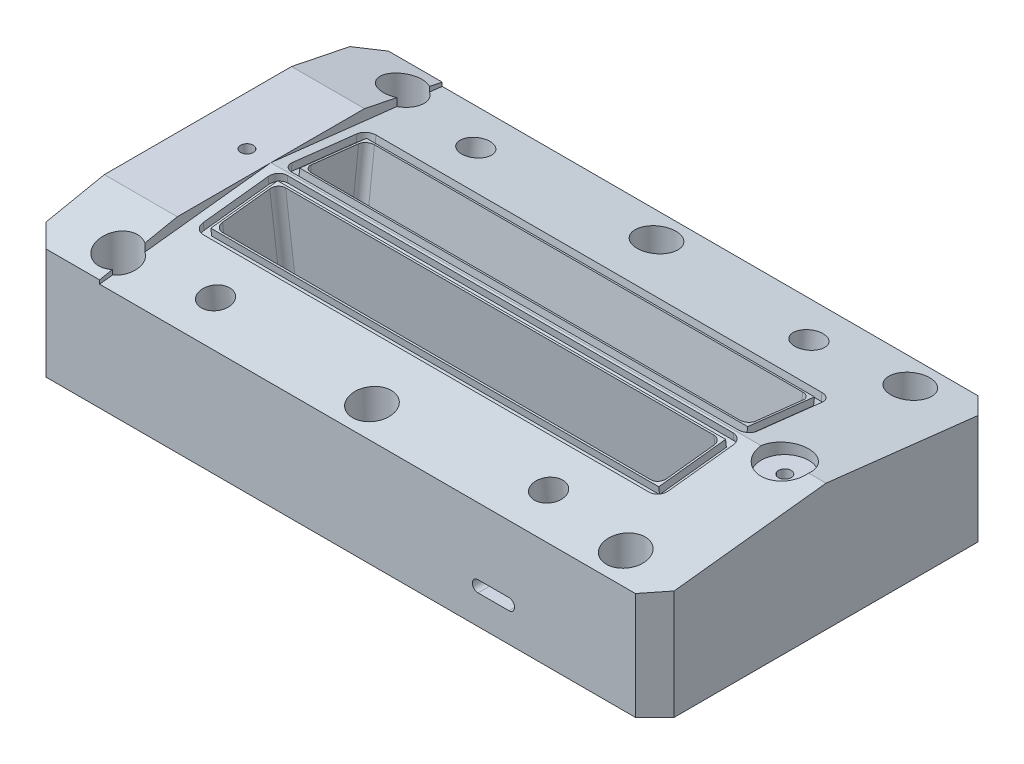
from build123d import *

# Parameters (mm, degrees)
SKETCH1_W            = 198
SKETCH1_H            = 108
BOSS_EXTRUDE1_DEPTH  = 40
SKETCH4_W            = 181
SKETCH4_H            = 45
CUT_EXTRUDE2_DEPTH   = 10
CUT_EXTRUDE3_DEPTH   = 175
BOSS_EXTRUDE11_DEPTH = 10
CUT_EXTRUDE12_DEPTH  = 175
CUT_EXTRUDE28_DEPTH  = 14.5
CUT_EXTRUDE29_DEPTH  = 14.5
CUT_EXTRUDE40_REACH  = 231.059
CUT_EXTRUDE5_DEPTH   = 23
SKETCH12_R           = 3.15
CUT_EXTRUDE9_DEPTH   = 230.058944379
SKETCH13_R           = 4.5
CUT_EXTRUDE10_DEPTH  = 16.5
SKETCH14_R           = 4.5
CUT_EXTRUDE11_DEPTH  = 16.5
SKETCH41_R           = 2.9
CUT_EXTRUDE21_DEPTH  = 7
CUT_EXTRUDE22_DEPTH  = 10
CUT_EXTRUDE23_DEPTH  = 10
SKETCH6_W            = 141.2
SKETCH6_H            = 21.2
CUT_EXTRUDE32_DEPTH  = 2.3
SKETCH23_W           = 141.2
SKETCH23_H           = 21.2
CUT_EXTRUDE33_DEPTH  = 2.3
CUT_EXTRUDE34_DEPTH  = 55.4
CUT_EXTRUDE35_DEPTH  = 55.4
CUT_EXTRUDE36_DEPTH  = 55.4
SKETCH90_R           = 6.1
CUT_EXTRUDE38_DEPTH  = 17
SKETCH96_R           = 2
CUT_EXTRUDE39_DEPTH  = 230.058944379
SKETCH98_R           = 7.5
CUT_EXTRUDE41_DEPTH  = 4


with BuildPart() as part:
    # Sketch1 → Boss-Extrude1 (new body)
    with BuildSketch(Plane(origin=(0, 0, 0), x_dir=(1, 0, 0), z_dir=(0, 1, 0))):
        with Locations((99, 54)):
            Rectangle(SKETCH1_W, SKETCH1_H)
    extrude(amount=BOSS_EXTRUDE1_DEPTH)

    # Sketch4 → Cut-Extrude2 (cut)
    with BuildSketch(Plane(origin=(0, 0, 0), x_dir=(1, 0, 0), z_dir=(0, 1, 0))):
        with Locations((99, 54)):
            Rectangle(SKETCH4_W, SKETCH4_H)
    extrude(amount=CUT_EXTRUDE2_DEPTH, mode=Mode.SUBTRACT)

    # Sketch5 → Cut-Extrude3 (cut)
    with BuildSketch(Plane(origin=(198, 0, 0), x_dir=(0, 0, -1), z_dir=(1, 0, 0))):
        Polygon((54, 40), (108, 33.828382143), (108, 40), align=None)
    extrude(amount=-CUT_EXTRUDE3_DEPTH, mode=Mode.SUBTRACT)

    # Sketch53 → Boss-Extrude11 (add)
    with BuildSketch(Plane(origin=(0, 10, 0), x_dir=(-1, 0, 0), z_dir=(0, -1, 0))):
        Polygon((-8.5, 51.5), (-8.5, 31.5), (-39.5, 31.5), align=None)
        Polygon((-8.5, 56.5), (-8.5, 76.5), (-39.5, 76.5), align=None)
        Polygon((-158.5, 76.5), (-189.5, 56.5), (-189.5, 76.5), align=None)
        Polygon((-158.5, 31.5), (-189.5, 51.5), (-189.5, 31.5), align=None)
    extrude(amount=BOSS_EXTRUDE11_DEPTH)

    # Sketch18 → Cut-Extrude12 (cut)
    with BuildSketch(Plane(origin=(198, 0, 0), x_dir=(0, 0, -1), z_dir=(1, 0, 0))):
        Polygon((0, 33.828382143), (0, 40), (54, 40), align=None)
    extrude(amount=-CUT_EXTRUDE12_DEPTH, mode=Mode.SUBTRACT)

    # Izq → Cut-Extrude28 (cut)
    with BuildSketch(Plane(origin=(0, 28.012686094, -12.204810084), x_dir=(1, 0, 0), z_dir=(0, 0.9167660546215652, -0.39942458749256926))):
        Polygon((8.5, 48.862182113), (29.5, 70.132603179), (8.5, 70.132603179), align=None)
    cut_extrude28 = extrude(amount=-CUT_EXTRUDE28_DEPTH, mode=Mode.SUBTRACT)

    # Der → Cut-Extrude29 (cut)
    with BuildSketch(Plane(origin=(0, -11.144923858, -4.62106599), x_dir=(1, 0, 0), z_dir=(0, 0.9237421135716327, 0.38301502270043264))):
        Polygon((8.5, 51.290217599), (29.5, 29.097876578), (8.5, 29.097876578), align=None)
    cut_extrude29 = extrude(amount=-CUT_EXTRUDE29_DEPTH, mode=Mode.SUBTRACT)

    # Cut-Extrude40: up to this face of the body (flat: up to its plane)
    cut_extrude40_end = Plane(part.part.faces().sort_by_distance((99, 10, -54))[0])
    # Sketch97 → Cut-Extrude40 (cut, up to the picked face)
    with BuildSketch(Plane(origin=(0, 0, 0), x_dir=(1, 0, 0), z_dir=(0, 1, 0)), mode=Mode.PRIVATE) as cut_extrude40_sk1:
        Polygon((8.5, 57.5), (29.5, 76.5), (158.5, 76.5), (189.5, 56.5), (189.5, 51.5), (158.5, 31.5), (29.5, 31.5), (8.5, 51.5), align=None)
    cut_extrude40_tool1 = split(extrude(cut_extrude40_sk1.sketch, amount=CUT_EXTRUDE40_REACH, mode=Mode.PRIVATE), bisect_by=cut_extrude40_end, keep=Keep.BOTH, mode=Mode.PRIVATE)
    cut_extrude40 = cut_extrude40_tool1.solids().sort_by(Axis((96.82024, 0, -54.014019), (0, 1, 0)))[0]
    add(cut_extrude40, mode=Mode.SUBTRACT)

    # Mirror2: Cut-Extrude28, Cut-Extrude29, Cut-Extrude40 across plane
    add(cut_extrude28.mirror(Plane(origin=(99, 0, 0), x_dir=(0, 0, 1), z_dir=(1, 0, 0))), mode=Mode.SUBTRACT)
    add(cut_extrude29.mirror(Plane(origin=(99, 0, 0), x_dir=(0, 0, 1), z_dir=(1, 0, 0))), mode=Mode.SUBTRACT)
    add(cut_extrude40.mirror(Plane(origin=(99, 0, 0), x_dir=(0, 0, 1), z_dir=(1, 0, 0))), mode=Mode.SUBTRACT)

    # Sketch7 → Cut-Extrude5 (cut)
    with BuildSketch(Plane(origin=(0, 0, 0), x_dir=(0, 0, -1), z_dir=(1, 0, 0))):
        Polygon((108, 40), (108, 35), (83.505102572, 40), align=None)
        Polygon((0, 35), (0, 40), (24.494897428, 40), align=None)
    extrude(amount=CUT_EXTRUDE5_DEPTH, mode=Mode.SUBTRACT)

    # Sketch12 → Cut-Extrude9 (cut, through all)
    with BuildSketch(Plane(origin=(0, 40, 0), x_dir=(1, 0, 0), z_dir=(0, 1, 0))):
        with Locations(Location((19.7, 98.85, 0), (0, 0, 270))):
            Circle(SKETCH12_R)
        with Locations(Location((99.7, 9.15, 0), (0, 0, 270))):
            Circle(SKETCH12_R)
        with Locations(Location((179.7, 9.15, 0), (0, 0, 270))):
            Circle(SKETCH12_R)
        with Locations(Location((19.7, 9.15, 0), (0, 0, 270))):
            Circle(SKETCH12_R)
        with Locations(Location((99.7, 98.85, 0), (0, 0, 270))):
            Circle(SKETCH12_R)
        with Locations(Location((179.7, 98.85, 0), (0, 0, 270))):
            Circle(SKETCH12_R)
    extrude(amount=-CUT_EXTRUDE9_DEPTH, mode=Mode.SUBTRACT)

    # Sketch13 → Cut-Extrude10 (cut)
    with BuildSketch(Plane(origin=(0, 45.576299066, -5.208879651), x_dir=(1, 0, 0), z_dir=(0, 0.9935322797694506, -0.11355002886885623))):
        with Locations(Location((46.5, 90.460272446, 0), (0, 0, 270))):
            Circle(SKETCH13_R)
        with Locations(Location((151.5, 90.460272446, 0), (0, 0, 270))):
            Circle(SKETCH13_R)
    extrude(amount=-CUT_EXTRUDE10_DEPTH, mode=Mode.SUBTRACT)

    # Sketch14 → Cut-Extrude11 (cut)
    with BuildSketch(Plane(origin=(0, 33.058773264, 6.733871157), x_dir=(1, 0, 0), z_dir=(0, 0.9935322797694507, 0.11355002886885664))):
        with Locations(Location((46.5, 19.910744715, 0), (0, 0, 270))):
            Circle(SKETCH14_R)
        with Locations(Location((151.5, 19.910744715, 0), (0, 0, 270))):
            Circle(SKETCH14_R)
    extrude(amount=-CUT_EXTRUDE11_DEPTH, mode=Mode.SUBTRACT)

    # Sketch41 → Cut-Extrude21 (cut)
    with BuildSketch(Plane(origin=(0, 0, 0), x_dir=(1, 0, 0), z_dir=(0, 1, 0))):
        with Locations(Location((139.5, 9, 0), (0, 0, 90))):
            Circle(SKETCH41_R)
        with Locations(Location((139.5, 99, 0), (0, 0, 90))):
            Circle(SKETCH41_R)
    extrude(amount=CUT_EXTRUDE21_DEPTH, mode=Mode.SUBTRACT)

    # Sketch42 → Cut-Extrude22 (cut)
    with BuildSketch(Plane.XY):
        with BuildLine():
            Line((142.3, 12.8), (152, 12.8))
            ThreePointArc((152, 12.8), (153.8, 11), (152, 9.2))
            Line((152, 9.2), (142.3, 9.2))
            ThreePointArc((142.3, 9.2), (140.5, 11), (142.3, 12.8))
        make_face()
    extrude(amount=-CUT_EXTRUDE22_DEPTH, mode=Mode.SUBTRACT)

    # Sketch43 → Cut-Extrude23 (cut)
    with BuildSketch(Plane(origin=(0, 0, -108), x_dir=(-1, 0, 0), z_dir=(0, 0, -1))):
        with BuildLine():
            Line((-55.7, 12.8), (-46, 12.8))
            ThreePointArc((-46, 12.8), (-44.2, 11), (-46, 9.2))
            Line((-46, 9.2), (-55.7, 9.2))
            ThreePointArc((-55.7, 9.2), (-57.5, 11), (-55.7, 12.8))
        make_face()
    extrude(amount=-CUT_EXTRUDE23_DEPTH, mode=Mode.SUBTRACT)

    # Sketch6 → Cut-Extrude32 (cut)
    with BuildSketch(Plane(origin=(0, 45.576299066, -5.208879651), x_dir=(1, 0, 0), z_dir=(0, 0.9935322797694506, -0.11355002886885623))):
        with BuildLine():
            Line((28.9, 76.508741953), (169.5, 76.508741953))
            ThreePointArc((169.5, 76.508741953), (171.621320344, 75.630062296), (172.5, 73.508741953))
            Line((172.5, 73.508741953), (172.5, 52.908741953))
            ThreePointArc((172.5, 52.908741953), (171.621320344, 50.787421609), (169.5, 49.908741953))
            Line((169.5, 49.908741953), (28.9, 49.908741953))
            ThreePointArc((28.9, 49.908741953), (26.778679656, 50.787421609), (25.9, 52.908741953))
            Line((25.9, 52.908741953), (25.9, 73.508741953))
            ThreePointArc((25.9, 73.508741953), (26.778679656, 75.630062296), (28.9, 76.508741953))
        make_face()
        with Locations((99.2, 63.208741953)):
            Rectangle(SKETCH6_W, SKETCH6_H, mode=Mode.SUBTRACT)
    extrude(amount=-CUT_EXTRUDE32_DEPTH, mode=Mode.SUBTRACT)

    # Sketch23 → Cut-Extrude33 (cut)
    with BuildSketch(Plane(origin=(0, 33.392212209, 3.816369873), x_dir=(1, 0, 0), z_dir=(0, 0.9935322797694506, 0.11355002886885662))):
        with BuildLine():
            Line((28.9, 57.392744262), (169.5, 57.392744262))
            ThreePointArc((169.5, 57.392744262), (171.621320344, 56.514064606), (172.5, 54.392744262))
            Line((172.5, 54.392744262), (172.5, 33.792744262))
            ThreePointArc((172.5, 33.792744262), (171.621320344, 31.671423919), (169.5, 30.792744262))
            Line((169.5, 30.792744262), (28.9, 30.792744262))
            ThreePointArc((28.9, 30.792744262), (26.778679656, 31.671423919), (25.9, 33.792744262))
            Line((25.9, 33.792744262), (25.9, 54.392744262))
            ThreePointArc((25.9, 54.392744262), (26.778679656, 56.514064606), (28.9, 57.392744262))
        make_face()
        with Locations((99.2, 44.092744262)):
            Rectangle(SKETCH23_W, SKETCH23_H, mode=Mode.SUBTRACT)
    extrude(amount=-CUT_EXTRUDE33_DEPTH, mode=Mode.SUBTRACT)

    # Sketch83 → Cut-Extrude34 (cut)
    with BuildSketch(Plane(origin=(0, 33.392212209, 3.816369873), x_dir=(1, 0, 0), z_dir=(0, 0.9935322797694506, 0.11355002886885662))):
        with BuildLine():
            Line((31.7, 54.092744262), (166.7, 54.092744262))
            ThreePointArc((166.7, 54.092744262), (168.467766953, 53.360511215), (169.2, 51.592744262))
            Line((169.2, 51.592744262), (169.2, 36.592744262))
            ThreePointArc((169.2, 36.592744262), (168.467766953, 34.824977309), (166.7, 34.092744262))
            Line((166.7, 34.092744262), (31.7, 34.092744262))
            ThreePointArc((31.7, 34.092744262), (29.932233047, 34.824977309), (29.2, 36.592744262))
            Line((29.2, 36.592744262), (29.2, 51.592744262))
            ThreePointArc((29.2, 51.592744262), (29.932233047, 53.360511215), (31.7, 54.092744262))
        make_face()
    extrude(amount=-CUT_EXTRUDE34_DEPTH, mode=Mode.SUBTRACT)

    # Sketch84 → Cut-Extrude35 (cut)
    with BuildSketch(Plane(origin=(0, 45.576299066, -5.208879651), x_dir=(1, 0, 0), z_dir=(0, 0.9935322797694506, -0.11355002886885623))):
        with BuildLine():
            Line((31.7, 53.208741953), (166.7, 53.208741953))
            ThreePointArc((166.7, 53.208741953), (168.467766953, 53.940975), (169.2, 55.708741953))
            Line((169.2, 55.708741953), (169.2, 70.708741953))
            ThreePointArc((169.2, 70.708741953), (168.467766953, 72.476508906), (166.7, 73.208741953))
            Line((166.7, 73.208741953), (31.7, 73.208741953))
            ThreePointArc((31.7, 73.208741953), (29.932233047, 72.476508906), (29.2, 70.708741953))
            Line((29.2, 70.708741953), (29.2, 55.708741953))
            ThreePointArc((29.2, 55.708741953), (29.932233047, 53.940975), (31.7, 53.208741953))
        make_face()
    extrude(amount=-CUT_EXTRUDE35_DEPTH, mode=Mode.SUBTRACT)

    # Sketch85 → Cut-Extrude36 (cut)
    with BuildSketch(Plane(origin=(0, 40, 0), x_dir=(1, 0, 0), z_dir=(0, 1, 0))):
        Polygon((0, 101.9), (6.1, 108), (0, 108), align=None)
        Polygon((0, 0), (6.1, 0), (0, 6.1), align=None)
        Polygon((198, 6.1), (191.9, 0), (198, 0), align=None)
        Polygon((198, 108), (191.9, 108), (198, 101.9), align=None)
    extrude(amount=-CUT_EXTRUDE36_DEPTH, mode=Mode.SUBTRACT)

    # Sketch90 → Cut-Extrude38 (cut)
    with BuildSketch(Plane(origin=(0, 40, 0), x_dir=(1, 0, 0), z_dir=(0, 1, 0))):
        with Locations(Location((19.7, 9.15, 0), (0, 0, 270))):
            Circle(SKETCH90_R)
        with Locations(Location((99.7, 9.15, 0), (0, 0, 270))):
            Circle(SKETCH90_R)
        with Locations(Location((179.7, 9.15, 0), (0, 0, 270))):
            Circle(SKETCH90_R)
        with Locations(Location((99.7, 98.85, 0), (0, 0, 270))):
            Circle(SKETCH90_R)
        with Locations(Location((179.7, 98.85, 0), (0, 0, 270))):
            Circle(SKETCH90_R)
        with Locations(Location((19.7, 98.85, 0), (0, 0, 270))):
            Circle(SKETCH90_R)
    extrude(amount=-CUT_EXTRUDE38_DEPTH, mode=Mode.SUBTRACT)

    # Sketch96 → Cut-Extrude39 (cut, through all)
    with BuildSketch(Plane(origin=(0, 0, 0), x_dir=(1, 0, 0), z_dir=(0, 1, 0))):
        with Locations(Location((15.45, 54, 0), (0, 0, 270))):
            Circle(SKETCH96_R)
        with Locations((185, 54)):
            Circle(SKETCH96_R)
    extrude(amount=CUT_EXTRUDE39_DEPTH, mode=Mode.SUBTRACT)

    # Sketch98 → Cut-Extrude41 (cut)
    with BuildSketch(Plane(origin=(0, 40, 0), x_dir=(1, 0, 0), z_dir=(0, 1, 0))):
        with Locations(Location((185, 54, 0), (0, 0, 270))):
            Circle(SKETCH98_R)
    extrude(amount=-CUT_EXTRUDE41_DEPTH, mode=Mode.SUBTRACT)


solid = part.part
